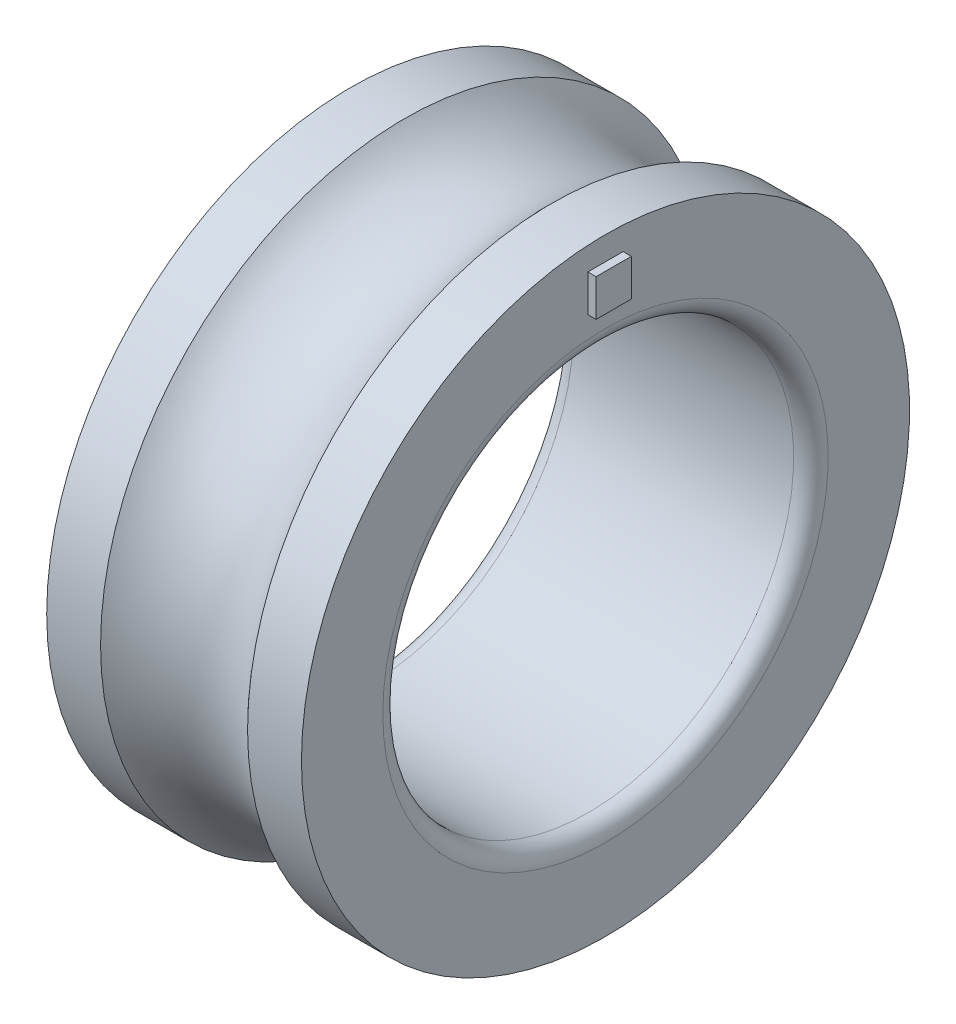
from build123d import *

# Parameters (mm, degrees)
SKETCH2_W           = 4.289378808
SKETCH2_H           = 4.50384775
BOSS_EXTRUDE1_DEPTH = 1


with BuildPart() as part:
    # Sketch1 → Revolve2 (revolve)
    with BuildSketch(Plane.XY, mode=Mode.PRIVATE) as revolve2_sk:
        with BuildLine():
            Line((-15.5, 37), (-8.94427191, 37))
            ThreePointArc((-8.94427191, 37), (0, 33), (8.94427191, 37))
            Line((8.94427191, 37), (15.5, 37))
            Line((15.5, 37), (15.5, 27.1))
            ThreePointArc((15.5, 27.1), (14.88492424, 25.61507576), (13.4, 25))
            Line((13.4, 25), (-13.4, 25))
            ThreePointArc((-13.4, 25), (-14.88492424, 25.61507576), (-15.5, 27.1))
            Line((-15.5, 27.1), (-15.5, 37))
        make_face()
    revolve(revolve2_sk.sketch.rotate(Axis((-15.146387833, 0, 0), (1, 0, 0)), 90), axis=Axis((-15.146387833, 0, 0), (1, 0, 0)))

    # Sketch2 → Boss-Extrude1 (add)
    with BuildSketch(Plane(origin=(15.5, 0, 0), x_dir=(0, 0, -1), z_dir=(1, 0, 0))):
        with Locations((0, 31.871583754)):
            Rectangle(SKETCH2_W, SKETCH2_H)
    extrude(amount=BOSS_EXTRUDE1_DEPTH)


solid = part.part
